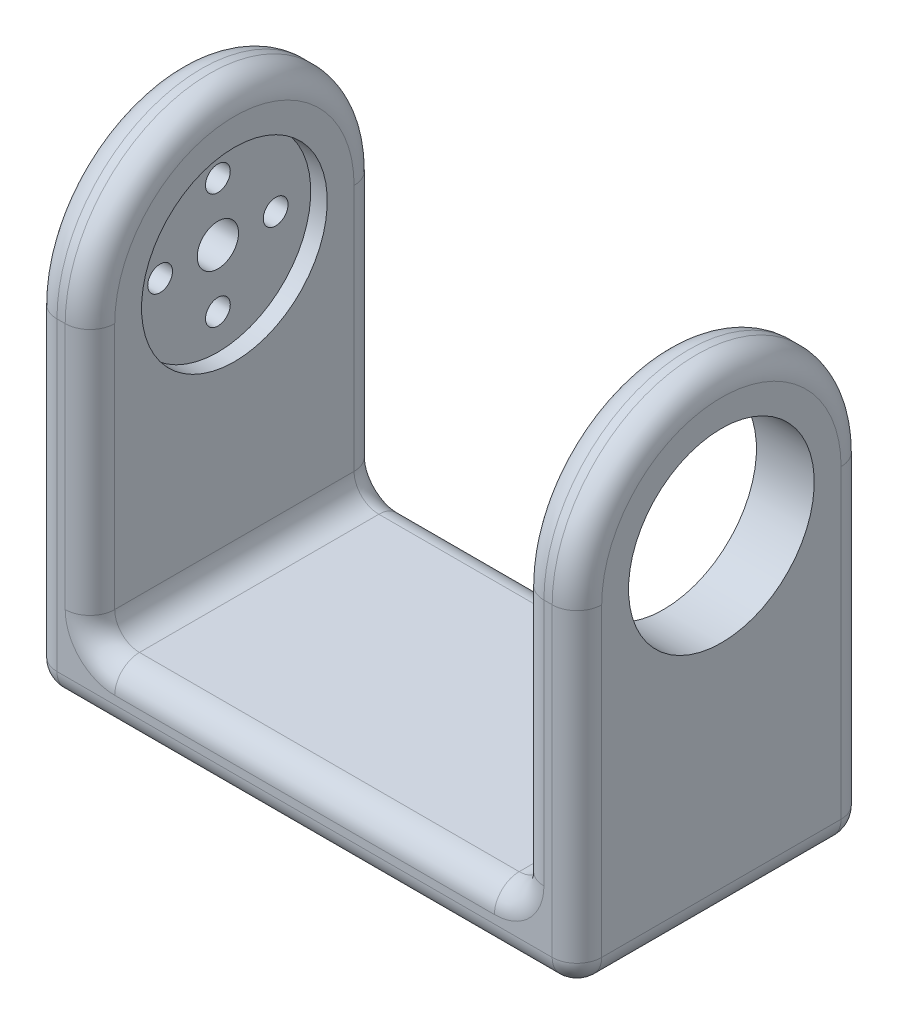
from build123d import *

# Parameters (mm, degrees)
EXTRUDE_THIN1_DEPTH = 17.5
BOSS_EXTRUDE2_DEPTH = 7
BOSS_EXTRUDE3_START = -59
BOSS_EXTRUDE3_DEPTH = 7
FILLET1_R           = 3
CUT_EXTRUDE1_START  = -7
CUT_EXTRUDE1_DEPTH  = 2
CUT_EXTRUDE2_START  = -66
CUT_EXTRUDE2_DEPTH  = 7
CUT_EXTRUDE3_REACH  = 87.636
SKETCH4_R           = 2.5
CUT_EXTRUDE4_REACH  = 87.636
SKETCH4_3_R         = 1.5
CIRPATTERN1_COUNT   = 4


with BuildPart() as part:
    # Sketch2 → Extrude-Thin1 (new, symmetric)
    with BuildSketch(Plane.XY):
        Polygon((-33, 40), (-33, 0), (33, 0), (33, 40), (26, 40), (26, 7), (-26, 7), (-26, 40), align=None)
    extrude(amount=EXTRUDE_THIN1_DEPTH, both=True)

    # Sketch3 → Boss-Extrude2 (add)
    with BuildSketch(Plane.ZY.offset(33)):
        with BuildLine():
            Line((11.25, 40), (17.5, 40))
            ThreePointArc((17.5, 40), (0, 57.5), (-17.5, 40))
            Line((-17.5, 40), (-11.25, 40))
            ThreePointArc((-11.25, 40), (0, 51.25), (11.25, 40))
        make_face()
        with BuildLine():
            ThreePointArc((-17.5, 40), (0, 22.5), (17.5, 40))
            Line((17.5, 40), (11.25, 40))
            ThreePointArc((11.25, 40), (0, 28.75), (-11.25, 40))
            Line((-11.25, 40), (-17.5, 40))
        make_face()
        with BuildLine():
            Line((-11.25, 40), (11.25, 40))
            ThreePointArc((11.25, 40), (0, 51.25), (-11.25, 40))
        make_face()
        with BuildLine():
            ThreePointArc((-11.25, 40), (0, 28.75), (11.25, 40))
            Line((11.25, 40), (-11.25, 40))
        make_face()
    extrude(amount=-BOSS_EXTRUDE2_DEPTH)

    # Sketch3<3> → Boss-Extrude3 (add)
    with BuildSketch(Plane.ZY.offset(33).offset(BOSS_EXTRUDE3_START)):
        with BuildLine():
            Line((-11.25, 40), (11.25, 40))
            ThreePointArc((11.25, 40), (0, 51.25), (-11.25, 40))
        make_face()
        with BuildLine():
            ThreePointArc((-11.25, 40), (0, 28.75), (11.25, 40))
            Line((11.25, 40), (-11.25, 40))
        make_face()
        with BuildLine():
            Line((11.25, 40), (17.5, 40))
            ThreePointArc((17.5, 40), (0, 57.5), (-17.5, 40))
            Line((-17.5, 40), (-11.25, 40))
            ThreePointArc((-11.25, 40), (0, 51.25), (11.25, 40))
        make_face()
        with BuildLine():
            ThreePointArc((-17.5, 40), (0, 22.5), (17.5, 40))
            Line((17.5, 40), (11.25, 40))
            ThreePointArc((11.25, 40), (0, 28.75), (-11.25, 40))
            Line((-11.25, 40), (-17.5, 40))
        make_face()
    extrude(amount=-BOSS_EXTRUDE3_DEPTH)

    # Fillet1
    fillet1_edges = [part.edges().sort_by_distance(p)[0] for p in [
        (-26, 7, 0),
        (26, 7, 0),
        (33, 0, 0),
        (-33, 0, 0),
        (-33, 20, 17.5),
        (0, 0, 17.5),
        (33, 20, 17.5),
        (-33, 57.5, 0),
        (-26, 57.5, 0),
        (26, 23.5, 17.5),
        (33, 57.5, 0),
        (26, 57.5, 0),
        (0, 7, 17.5),
        (-26, 23.5, 17.5),
        (0, 7, -17.5),
        (26, 23.5, -17.5),
        (33, 20, -17.5),
        (0, 0, -17.5),
        (-33, 20, -17.5),
        (-26, 23.5, -17.5),
    ]]
    fillet(fillet1_edges, radius=FILLET1_R)

    # Sketch3<4> → Cut-Extrude1 (cut)
    with BuildSketch(Plane.ZY.offset(33).offset(CUT_EXTRUDE1_START)):
        with BuildLine():
            Line((-11.25, 40), (11.25, 40))
            ThreePointArc((11.25, 40), (0, 51.25), (-11.25, 40))
        make_face()
        with BuildLine():
            ThreePointArc((-11.25, 40), (0, 28.75), (11.25, 40))
            Line((11.25, 40), (-11.25, 40))
        make_face()
    extrude(amount=CUT_EXTRUDE1_DEPTH, mode=Mode.SUBTRACT)

    # Sketch3<5> → Cut-Extrude2 (cut)
    with BuildSketch(Plane.ZY.offset(33).offset(CUT_EXTRUDE2_START)):
        with BuildLine():
            Line((-11.25, 40), (11.25, 40))
            ThreePointArc((11.25, 40), (0, 51.25), (-11.25, 40))
        make_face()
        with BuildLine():
            ThreePointArc((-11.25, 40), (0, 28.75), (11.25, 40))
            Line((11.25, 40), (-11.25, 40))
        make_face()
    extrude(amount=CUT_EXTRUDE2_DEPTH, mode=Mode.SUBTRACT)

    # Sketch4 → Cut-Extrude3 (cut, up to next)
    with BuildSketch(Plane(origin=(-28, 0, 0), x_dir=(0, 0, -1), z_dir=(1, 0, 0)), mode=Mode.PRIVATE) as cut_extrude3_sk1:
        with Locations(Location((0, 40, 0), (0, 0, 90))):
            Circle(SKETCH4_R)
    cut_extrude3_tool1 = extrude(cut_extrude3_sk1.sketch, amount=-CUT_EXTRUDE3_REACH, mode=Mode.PRIVATE) & part.part
    add(cut_extrude3_tool1.solids().sort_by_distance((-28, 40, 0))[0], mode=Mode.SUBTRACT)

    # Sketch4<3> → Cut-Extrude4 (cut, up to next)
    with BuildSketch(Plane(origin=(-28, 0, 0), x_dir=(0, 0, -1), z_dir=(1, 0, 0)), mode=Mode.PRIVATE) as cut_extrude4_sk1:
        with Locations(Location((7, 40, 0), (0, 0, 90))):
            Circle(SKETCH4_3_R)
    cut_extrude4_tool1 = extrude(cut_extrude4_sk1.sketch, amount=-CUT_EXTRUDE4_REACH, mode=Mode.PRIVATE) & part.part
    cut_extrude4 = cut_extrude4_tool1.solids().sort_by_distance((-28, 40, -7))[0]
    add(cut_extrude4, mode=Mode.SUBTRACT)

    # CirPattern1: Cut-Extrude4 ×4 about axis
    cirpattern1_axis = Axis((0, 40, 0), (1, 0, 0))
    for i in range(1, CIRPATTERN1_COUNT):
        add(cut_extrude4.rotate(cirpattern1_axis, i * 360 / CIRPATTERN1_COUNT), mode=Mode.SUBTRACT)


solid = part.part
